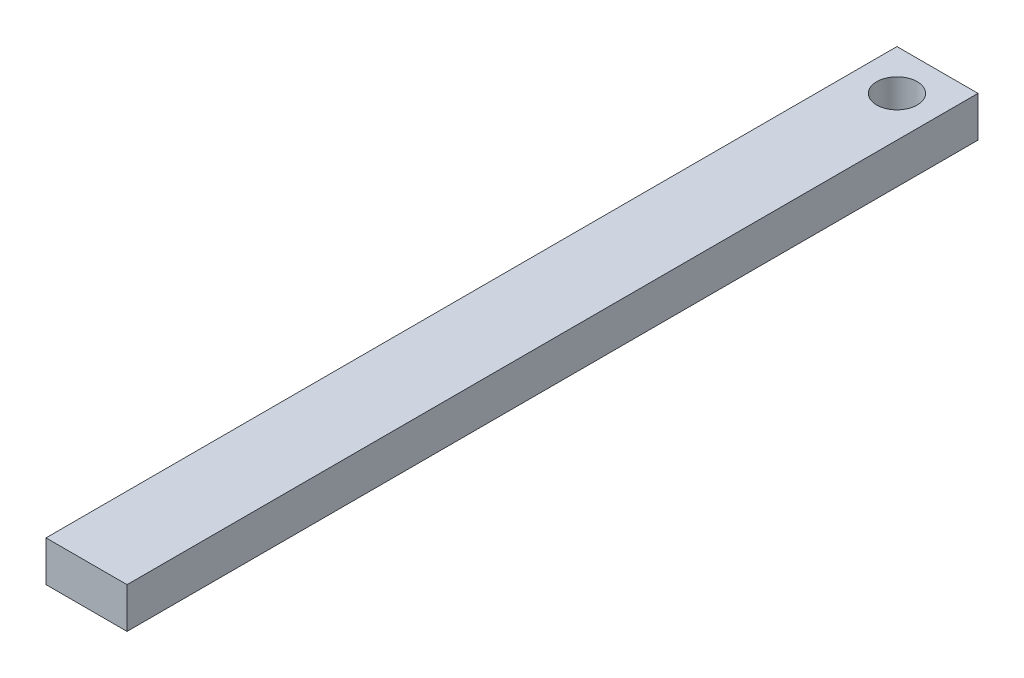
from build123d import *

# Parameters (mm, degrees)
SKETCH1_W           = 20
SKETCH1_H           = 210
BOSS_EXTRUDE2_DEPTH = 10
SKETCH2_R           = 5
CUT_EXTRUDE1_DEPTH  = 10


with BuildPart() as part:
    # Sketch1 → Boss-Extrude2 (new body)
    with BuildSketch(Plane(origin=(0, 0, 0), x_dir=(1, 0, 0), z_dir=(0, 1, 0))):
        with Locations((0, -105)):
            Rectangle(SKETCH1_W, SKETCH1_H)
    extrude(amount=BOSS_EXTRUDE2_DEPTH)

    # Sketch2 → Cut-Extrude1 (cut)
    with BuildSketch(Plane(origin=(0, 10, 0), x_dir=(1, 0, 0), z_dir=(0, 1, 0))):
        with Locations(Location((0, -10, 0), (0, 0, 270))):
            Circle(SKETCH2_R)
    extrude(amount=-CUT_EXTRUDE1_DEPTH, mode=Mode.SUBTRACT)


solid = part.part
